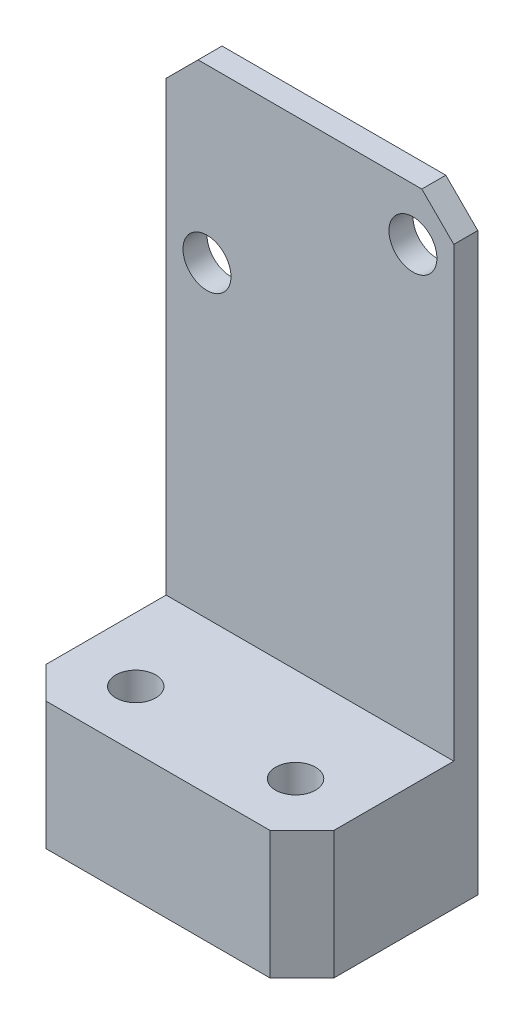
from build123d import *

# Parameters (mm, degrees)
SKETCH1_W             = 18
SKETCH1_H             = 38
EXTRUDE1_DEPTH        = 11
SKETCH2_W             = 18
SKETCH2_H             = 30
EXTRUDE2_DEPTH        = 9.5
SKETCH3_R             = 1.5
EXTRUDE3_DEPTH        = 1.5
SKETCH4_R             = 1.25
EXTRUDE5_DEPTH        = 8
M3_TAPPED_HOLE3_D     = 2.5
M3_TAPPED_HOLE3_DEPTH = 11.5
M3_TAPPED_HOLE3_TIP   = 0.751075774
CHAMFER2_SIZE         = 2


with BuildPart() as part:
    # Sketch1 → Extrude1 (new body)
    with BuildSketch(Plane.XY):
        with Locations((0, -12)):
            Rectangle(SKETCH1_W, SKETCH1_H)
    extrude(amount=EXTRUDE1_DEPTH)

    # Sketch2 → Extrude2 (cut)
    with BuildSketch(Plane.XY.offset(11)):
        with Locations((0, -8)):
            Rectangle(SKETCH2_W, SKETCH2_H)
    extrude(amount=-EXTRUDE2_DEPTH, mode=Mode.SUBTRACT)

    # Sketch3 → Extrude3 (cut)
    with BuildSketch(Plane.XY.offset(1.5)):
        with Locations((6.443229004, 3.72)):
            Circle(SKETCH3_R)
        with Locations((-6.443229004, -3.72)):
            Circle(SKETCH3_R)
    extrude(amount=-EXTRUDE3_DEPTH, mode=Mode.SUBTRACT)

    # Sketch4 → Extrude5 (cut)
    with BuildSketch(Plane(origin=(0, -23, 0), x_dir=(1, 0, 0), z_dir=(0, 1, 0))):
        with Locations(Location((-5, -7.4, 0), (0, 0, 180))):
            Circle(SKETCH4_R)
        with Locations(Location((5, -7.4, 0), (0, 0, 180))):
            Circle(SKETCH4_R)
    extrude(amount=-EXTRUDE5_DEPTH, mode=Mode.SUBTRACT)

    # M3 Tapped Hole3
    with Locations(Plane(origin=(5, -31, 7.4), x_dir=(0, 0, -1), z_dir=(0, -1, 0))):
        with Locations((0, 0), (0, -10)):
            Hole(M3_TAPPED_HOLE3_D / 2, depth=M3_TAPPED_HOLE3_DEPTH)
            with Locations((0, 0, -(M3_TAPPED_HOLE3_DEPTH + M3_TAPPED_HOLE3_TIP / 2))):  # 118° drill point
                Cone(0, M3_TAPPED_HOLE3_D / 2, M3_TAPPED_HOLE3_TIP, mode=Mode.SUBTRACT)

    # Chamfer2
    chamfer2_edges = [part.edges().sort_by_distance(p)[0] for p in [
        (9, -27, 11),
        (-9, -27, 11),
        (-9, 7, 0.75),
        (9, 7, 0.75),
    ]]
    chamfer(chamfer2_edges, length=CHAMFER2_SIZE)


solid = part.part
